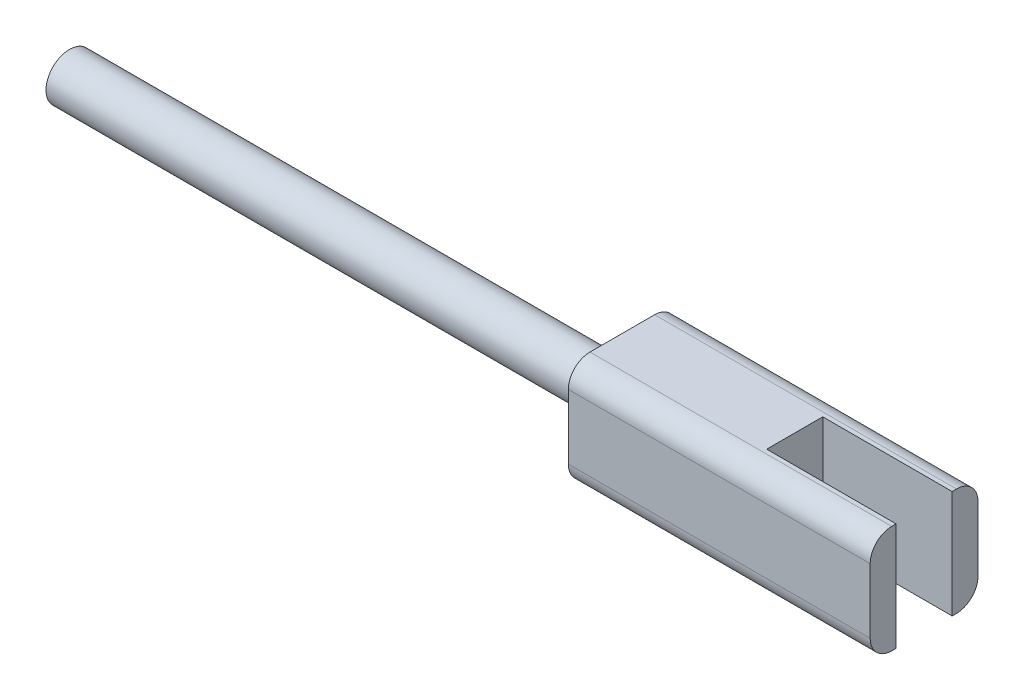
from build123d import *

# Parameters (mm, degrees)
SKETCH1_R               = 1.09
BOSS_EXTRUDE1_DEPTH     = 27.637
BOSS_EXTRUDE2_DEPTH     = 14
CUT_EXTRUDE1_DEPTH      = 40.794368559
CUT_EXTRUDE1_DEPTH_BACK = 40.794368559
SKETCH3_W               = 7
SKETCH3_H               = 2.6


with BuildPart() as part:
    # Sketch1 → Boss-Extrude1 (new body)
    with BuildSketch(Plane(origin=(0, 0, 0), x_dir=(0, 0, -1), z_dir=(1, 0, 0))):
        with Locations(Location((0, 0, 0), (0, 0, 180))):
            Circle(SKETCH1_R)
    extrude(amount=BOSS_EXTRUDE1_DEPTH)

    # Sketch2 → Boss-Extrude2 (add)
    with BuildSketch(Plane(origin=(25.637, 0, 0), x_dir=(0, 0, -1), z_dir=(1, 0, 0))):
        with BuildLine():
            Line((-1.5, -2.5), (1.5, -2.5))
            ThreePointArc((1.5, -2.5), (2.207106781, -2.207106781), (2.5, -1.5))
            Line((2.5, -1.5), (2.5, 1.5))
            ThreePointArc((2.5, 1.5), (2.207106781, 2.207106781), (1.5, 2.5))
            Line((1.5, 2.5), (-1.5, 2.5))
            ThreePointArc((-1.5, 2.5), (-2.207106781, 2.207106781), (-2.5, 1.5))
            Line((-2.5, 1.5), (-2.5, -1.5))
            ThreePointArc((-2.5, -1.5), (-2.207106781, -2.207106781), (-1.5, -2.5))
        make_face()
    extrude(amount=BOSS_EXTRUDE2_DEPTH)

    # Sketch3 → Cut-Extrude1 (cut, two sides: drawn at the far end of the back side and taken through both)
    with BuildSketch(Plane(origin=(0, 0, 0), x_dir=(1, 0, 0), z_dir=(0, 1, 0)).offset(-CUT_EXTRUDE1_DEPTH_BACK)):
        with Locations((37.137, 0)):
            Rectangle(SKETCH3_W, SKETCH3_H)
    extrude(amount=CUT_EXTRUDE1_DEPTH + CUT_EXTRUDE1_DEPTH_BACK, mode=Mode.SUBTRACT)


solid = part.part
